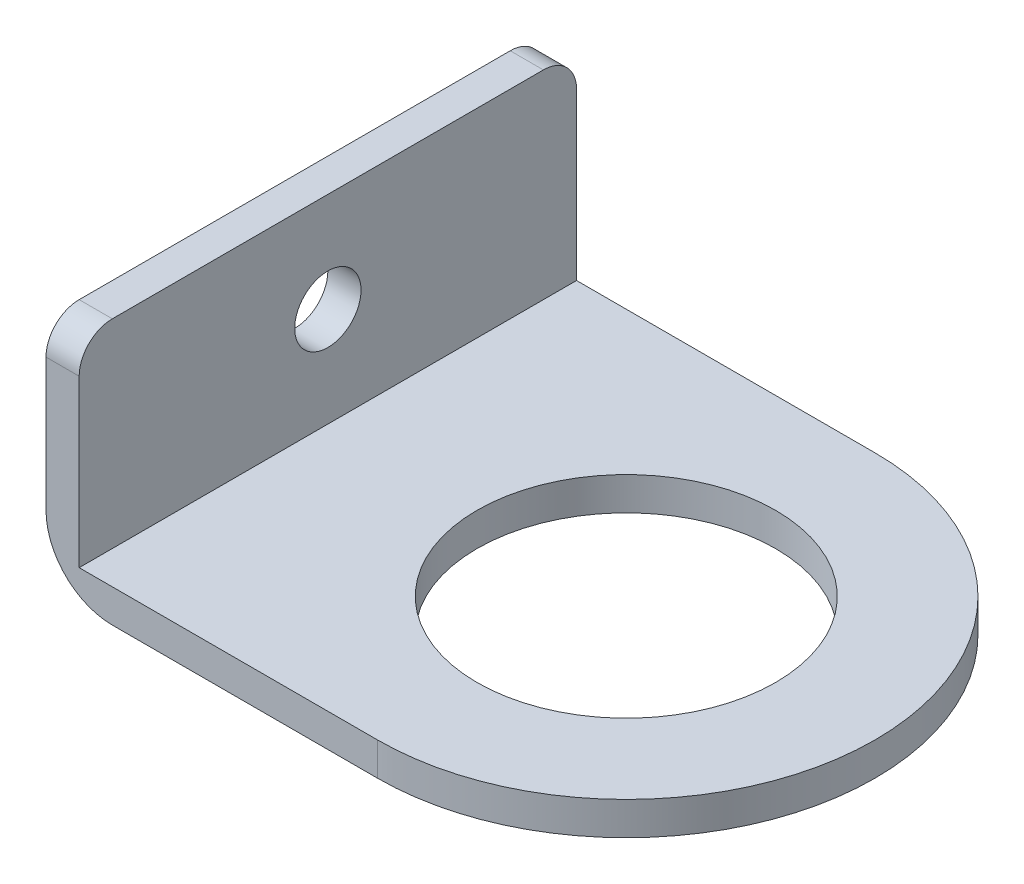
from build123d import *

# Parameters (mm, degrees)
BOSS_EXTRUDE1_DEPTH     = 30
EXTRUDE_THIN1_DEPTH     = 2
SKETCH3_R               = 9
CUT_EXTRUDE1_DEPTH      = 48.634021455
FILLET2_R               = 4
CUT_EXTRUDE2_DEPTH      = 49.176757882
CUT_EXTRUDE2_DEPTH_BACK = 49.176757882
SKETCH4_R               = 2
FILLET3_R               = 2


with BuildPart() as part:
    # Sketch1 → Boss-Extrude1 (new body)
    with BuildSketch(Plane.XY):
        Polygon((0, 0), (20, 0), (20, 2), (2, 2), (2, 14), (0, 14), align=None)
    extrude(amount=-BOSS_EXTRUDE1_DEPTH)

    # Sketch2 → Extrude-Thin1 (add)
    with BuildSketch(Plane(origin=(0, 0, 0), x_dir=(1, 0, 0), z_dir=(0, 1, 0))):
        with BuildLine():
            ThreePointArc((20, 30), (35, 15), (20, 0))
            Line((20, 0), (20, 10))
            ThreePointArc((20, 10), (25, 15), (20, 20))
            Line((20, 20), (20, 30))
        make_face()
    extrude(amount=EXTRUDE_THIN1_DEPTH)

    # Sketch3 → Cut-Extrude1 (cut, through all)
    with BuildSketch(Plane(origin=(0, 2, 0), x_dir=(1, 0, 0), z_dir=(0, 1, 0))):
        with Locations(Location((20, 15, 0), (0, 0, 180))):
            Circle(SKETCH3_R)
    extrude(amount=-CUT_EXTRUDE1_DEPTH, mode=Mode.SUBTRACT)

    # Fillet2
    fillet2_edges = [part.edges().sort_by_distance(p)[0] for p in [
        (0, 0, -15),
    ]]
    fillet(fillet2_edges, radius=FILLET2_R)

    # Sketch4 → Cut-Extrude2 (cut, two sides: drawn at the far end of the back side and taken through both)
    with BuildSketch(Plane(origin=(0, 0, 0), x_dir=(0, 0, -1), z_dir=(1, 0, 0)).offset(-CUT_EXTRUDE2_DEPTH_BACK)):
        with Locations((15, 8)):
            Circle(SKETCH4_R)
    extrude(amount=CUT_EXTRUDE2_DEPTH + CUT_EXTRUDE2_DEPTH_BACK, mode=Mode.SUBTRACT)

    # Fillet3
    fillet3_edges = [part.edges().sort_by_distance(p)[0] for p in [
        (1, 14, -30),
        (1, 14, 0),
    ]]
    fillet(fillet3_edges, radius=FILLET3_R)


solid = part.part
